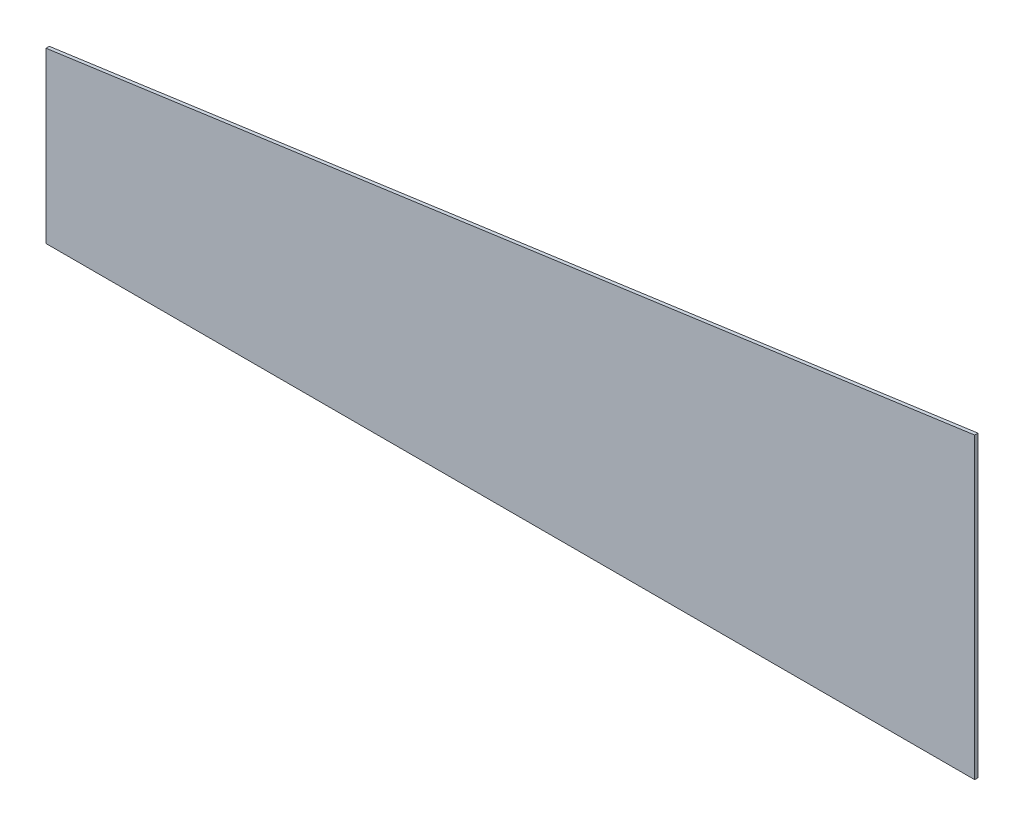
from build123d import *

# Parameters (mm, degrees)
BOSS_EXTRUDE1_DEPTH = 1


with BuildPart() as part:
    # Sketch1 → Boss-Extrude1 (new body)
    with BuildSketch(Plane.XY):
        Polygon((0, 0), (-280, 0), (-280, 51), (0, 90), align=None)
    extrude(amount=BOSS_EXTRUDE1_DEPTH)


solid = part.part
